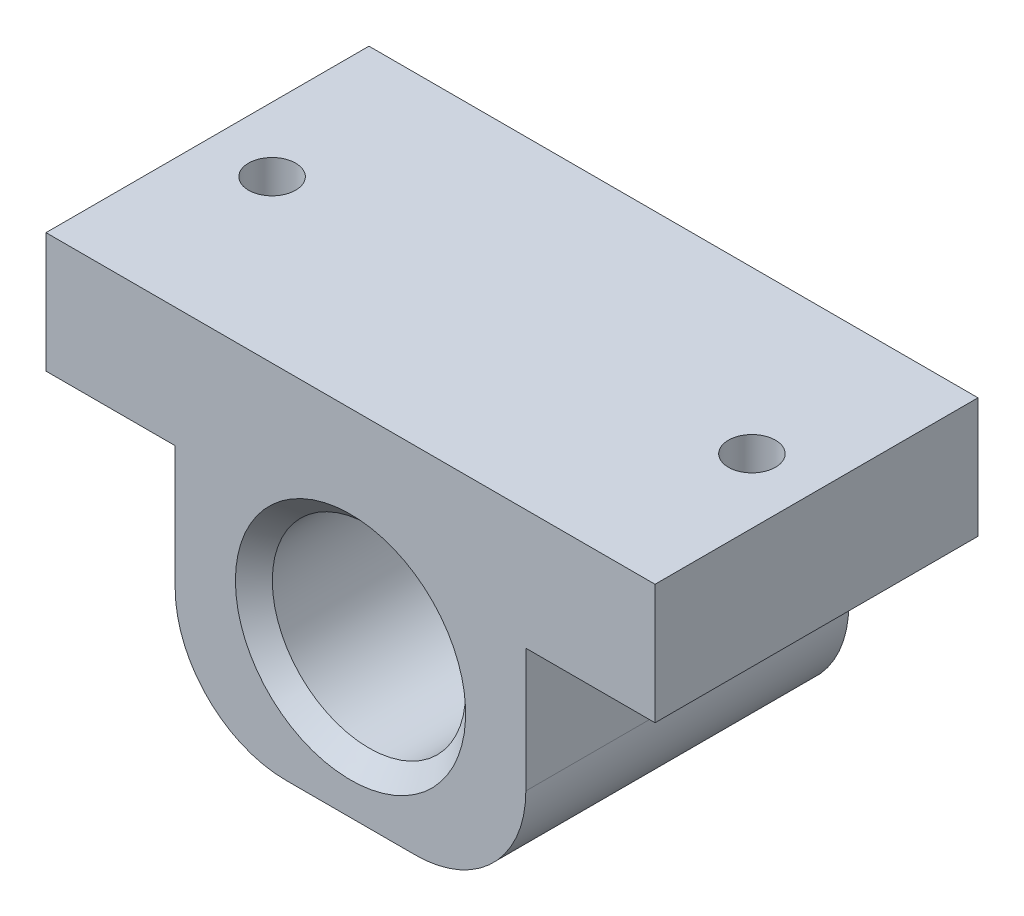
from build123d import *

# Parameters (mm, degrees)
CROQUIS1_R                 = 10.475
SALIENTE_EXTRUIR1_DEPTH    = 35
CROQUIS2_R                 = 2.55
CORTAR_EXTRUIR1_DEPTH      = 55.398161734
CHAFL_N1_SIZE              = 2
CORTAR_EXTRUIR2_REACH      = 63.551
CORTAR_EXTRUIR2_END_RADIUS = 10.475
CROQUIS3_R                 = 1.375


with BuildPart() as part:
    # Croquis1 → Saliente-Extruir1 (new body)
    with BuildSketch(Plane.XY):
        with BuildLine():
            Line((-33, 22.4), (33, 22.4))
            Line((33, 22.4), (33, 9.4))
            Line((33, 9.4), (19, 9.4))
            Line((19, 9.4), (19, -4))
            ThreePointArc((19, -4), (15.485281374, -12.485281374), (7, -16))
            Line((7, -16), (-7, -16))
            ThreePointArc((-7, -16), (-15.485281374, -12.485281374), (-19, -4))
            Line((-19, -4), (-19, 9.4))
            Line((-19, 9.4), (-33, 9.4))
            Line((-33, 9.4), (-33, 22.4))
        make_face()
        Circle(CROQUIS1_R, mode=Mode.SUBTRACT)
    extrude(amount=SALIENTE_EXTRUIR1_DEPTH)

    # Croquis2 → Cortar-Extruir1 (cut, through all)
    with BuildSketch(Plane.XZ.offset(-9.4)):
        with Locations((-26, 17.5)):
            Circle(CROQUIS2_R)
        with Locations((26, 17.5)):
            Circle(CROQUIS2_R)
    extrude(amount=-CORTAR_EXTRUIR1_DEPTH, mode=Mode.SUBTRACT)

    # Chaflán1
    chafl_n1_edges = [part.edges().sort_by_distance(p)[0] for p in [
        (-10.475, 0, 0),
        (-10.475, 0, 35),
    ]]
    chamfer(chafl_n1_edges, length=CHAFL_N1_SIZE)

    # Cortar-Extruir2: up to this cylinder (the profile starts outside it)
    cortar_extruir2_end = Plane(origin=(0, 0, 17.5), z_dir=(0, 0, -1)) * Cylinder(CORTAR_EXTRUIR2_END_RADIUS, 149.052, mode=Mode.PRIVATE)
    # Croquis3 → Cortar-Extruir2 (cut, up to the surface)
    with BuildSketch(Plane.XZ.offset(16), mode=Mode.PRIVATE) as cortar_extruir2_sk1:
        with Locations(Location((0, 17.5, 0), (0, 0, 270))):
            Circle(CROQUIS3_R)
    cortar_extruir2_tool1 = extrude(cortar_extruir2_sk1.sketch, amount=-CORTAR_EXTRUIR2_REACH, mode=Mode.PRIVATE) - cortar_extruir2_end
    add(cortar_extruir2_tool1.solids().sort_by_distance((0, -16, 17.5))[0], mode=Mode.SUBTRACT)


solid = part.part
